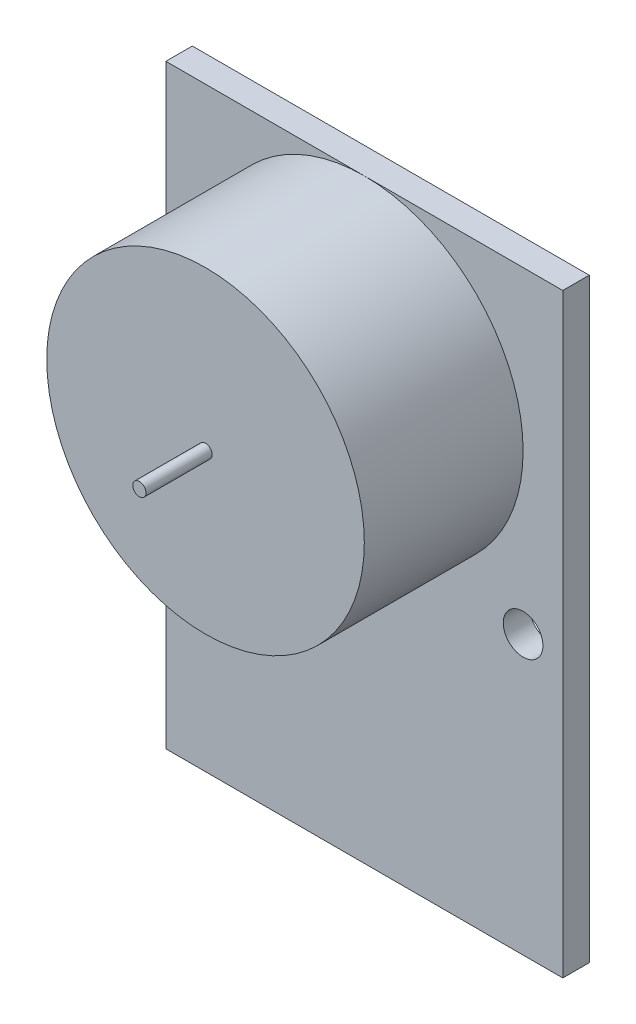
from build123d import *

# Parameters (mm, degrees)
SKETCH_1_W          = 30
SKETCH_1_H          = 45
EXTRUDE_1_DEPTH     = 2
SKETCH_2_R          = 12
EXTRUDE_2_DEPTH     = 12
CUT_EXTRUDE_1_REACH = 31.585
SKETCH_3_R          = 1.5
SKETCH_5_R          = 0.5
EXTRUDE_3_DEPTH     = 5


with BuildPart() as part:
    # 草图1 → 凸台-拉伸1 (new body)
    with BuildSketch(Plane.XY):
        Rectangle(SKETCH_1_W, SKETCH_1_H)
    extrude(amount=-EXTRUDE_1_DEPTH)

    # 草图2 → 凸台-拉伸2 (add)
    with BuildSketch(Plane.XY):
        with Locations(Location((0, 10.5, 0), (0, 0, 90))):
            Circle(SKETCH_2_R)
    extrude(amount=EXTRUDE_2_DEPTH)

    # 草图3 → 切除-拉伸1 (cut, up to next)
    with BuildSketch(Plane.XY, mode=Mode.PRIVATE) as cut_extrude_1_sk1:
        with Locations((-12, -1.5)):
            Circle(SKETCH_3_R)
    cut_extrude_1_tool1 = extrude(cut_extrude_1_sk1.sketch, amount=-CUT_EXTRUDE_1_REACH, mode=Mode.PRIVATE) & part.part
    # 草图3 → 切除-拉伸1 (cut, up to next)
    with BuildSketch(Plane.XY, mode=Mode.PRIVATE) as cut_extrude_1_sk2:
        with Locations(Location((12, -1.5, 0), (0, 0, 180))):
            Circle(SKETCH_3_R)
    cut_extrude_1_tool2 = extrude(cut_extrude_1_sk2.sketch, amount=-CUT_EXTRUDE_1_REACH, mode=Mode.PRIVATE) & part.part
    add(cut_extrude_1_tool1.solids().sort_by_distance((-12, -1.5, 0))[0], mode=Mode.SUBTRACT)
    add(cut_extrude_1_tool2.solids().sort_by_distance((12, -1.5, 0))[0], mode=Mode.SUBTRACT)

    # 草图5 → 凸台-拉伸3 (add)
    with BuildSketch(Plane.XY.offset(12)):
        with Locations((0, 10.5)):
            Circle(SKETCH_5_R)
    extrude(amount=EXTRUDE_3_DEPTH)


solid = part.part
